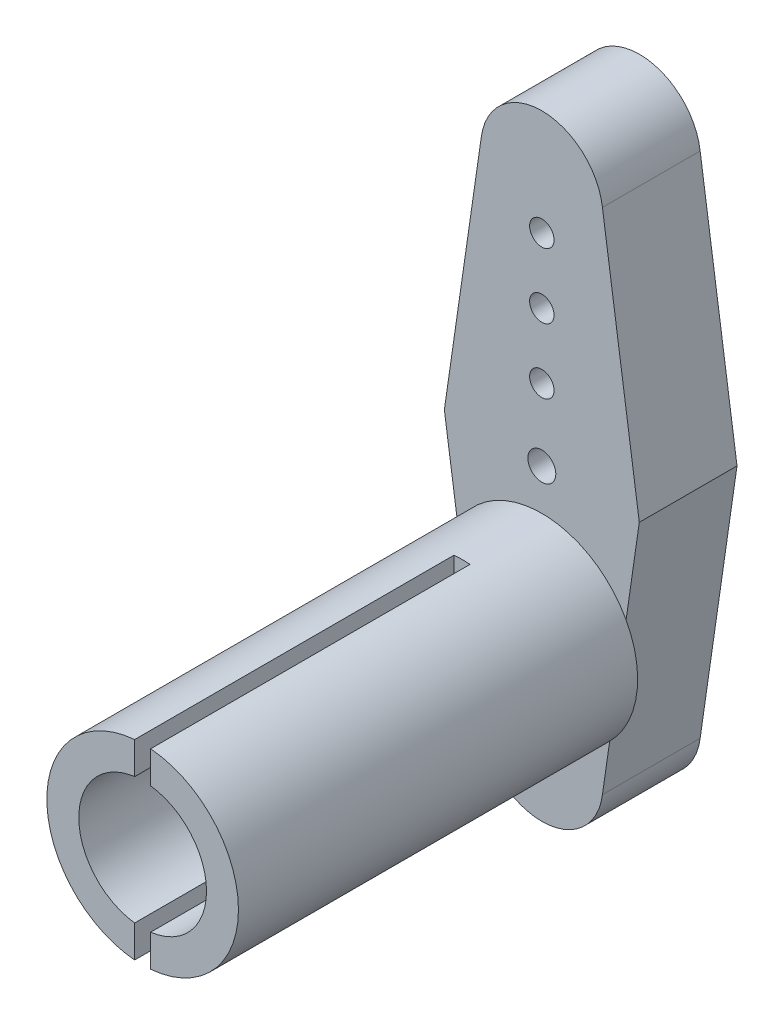
from build123d import *

# Parameters (mm, degrees)
BOSS_EXTRUDE1_DEPTH     = 6
CUT_EXTRUDE3_DEPTH      = 4.7
CUT_EXTRUDE4_DEPTH      = 21.471687766
CUT_EXTRUDE4_DEPTH_BACK = 21.471687766
SKETCH4_R               = 0.75
SKETCH6_R               = 0.75
CUT_EXTRUDE6_DEPTH      = 21.471687766
LPATTERN1_COUNT         = 3
LPATTERN1_PITCH         = 4
SCALE1_SCALE            = 1.02
SKETCH7_W               = 12.24
SKETCH7_H               = 6.12
CUT_EXTRUDE7_DEPTH      = 22.106506047
SKETCH8_R               = 0.875
CUT_EXTRUDE8_DEPTH      = 22.121773144
SKETCH9_R               = 6
SKETCH9_R_2             = 4
BOSS_EXTRUDE2_DEPTH     = 25
SKETCH10_W              = 1
SKETCH10_H              = 40
CUT_EXTRUDE9_DEPTH      = 38.052107321


with BuildPart() as part:
    # Sketch2 → Boss-Extrude1 (new body)
    with BuildSketch(Plane.XY):
        with BuildLine():
            Line((-6, 0), (-3.720572803, -15.718868867))
            ThreePointArc((-3.720572803, -15.718868867), (-5.969e-06, -19), (3.720571311, -15.71888071))
            Line((3.720571311, -15.71888071), (6, 0))
            ThreePointArc((6, 0), (0, 6), (-6, 0))
        make_face()
    extrude(amount=BOSS_EXTRUDE1_DEPTH)

    # Sketch3 → Cut-Extrude3 (cut)
    with BuildSketch(Plane.XY):
        with BuildLine():
            Line((-3.75, 0), (-2.25, -15))
            ThreePointArc((-2.25, -15), (0, -17.25), (2.25, -15))
            Line((2.25, -15), (3.75, 0))
            ThreePointArc((3.75, 0), (0, 3.75), (-3.75, 0))
        make_face()
    extrude(amount=CUT_EXTRUDE3_DEPTH, mode=Mode.SUBTRACT)

    # Sketch4 → Cut-Extrude4 (cut, two sides: drawn at the far end of the back side and taken through both)
    with BuildSketch(Plane(origin=(0, 0, 4.7), x_dir=(-1, 0, 0), z_dir=(0, 0, -1)).offset(-CUT_EXTRUDE4_DEPTH_BACK)):
        Circle(SKETCH4_R)
    extrude(amount=CUT_EXTRUDE4_DEPTH + CUT_EXTRUDE4_DEPTH_BACK, mode=Mode.SUBTRACT)

    # Sketch6 → Cut-Extrude6 (cut, symmetric)
    with BuildSketch(Plane(origin=(0, 0, 4.7), x_dir=(-1, 0, 0), z_dir=(0, 0, -1))):
        with Locations((0, -4.5)):
            Circle(SKETCH6_R)
    cut_extrude6 = extrude(amount=CUT_EXTRUDE6_DEPTH, both=True, mode=Mode.SUBTRACT)

    # LPattern1: Cut-Extrude6 ×3
    with Locations(*[(0, -i * LPATTERN1_PITCH, 0) for i in range(1, LPATTERN1_COUNT)]):
        add(cut_extrude6, mode=Mode.SUBTRACT)


with BuildPart() as part_1:
    # Scale1: scaled about (6e-08, -5.397561761, 3.434577722)
    add(part.part.scale(SCALE1_SCALE).moved(Location((-1e-09, 0.107951235, -0.068691554))))

    # Sketch7 → Cut-Extrude7 (cut, through all)
    with BuildSketch(Plane(origin=(0, 0, 0), x_dir=(1, 0, 0), z_dir=(0, 1, 0))):
        with Locations((-1e-09, -2.991308446)):
            Rectangle(SKETCH7_W, SKETCH7_H)
    extrude(amount=CUT_EXTRUDE7_DEPTH, mode=Mode.SUBTRACT)

    # Mirror3: part across plane


with BuildPart() as part_2:
    add(part_1.part)
    add(part_1.part.mirror(Plane.ZX))

    # Sketch8 → Cut-Extrude8 (cut, through all)
    with BuildSketch(Plane.XY.offset(6.051308446)):
        Circle(SKETCH8_R)
    extrude(amount=-CUT_EXTRUDE8_DEPTH, mode=Mode.SUBTRACT)

    # Sketch9 → Boss-Extrude2 (add)
    with BuildSketch(Plane.XY.offset(6.051308446)):
        with Locations(Location((-1e-09, -8.562048765, 0), (0, 0, 151.579121381))):
            Circle(SKETCH9_R)
        with Locations(Location((-1e-09, -8.562048765, 0), (0, 0, 100.806376462))):
            Circle(SKETCH9_R_2, mode=Mode.SUBTRACT)
    extrude(amount=BOSS_EXTRUDE2_DEPTH)

    # Sketch10 → Cut-Extrude9 (cut, through all)
    with BuildSketch(Plane(origin=(0, 0, 0), x_dir=(1, 0, 0), z_dir=(0, 1, 0))):
        with Locations((0, -31.051308446)):
            Rectangle(SKETCH10_W, SKETCH10_H)
    extrude(amount=-CUT_EXTRUDE9_DEPTH, mode=Mode.SUBTRACT)


solid = part_2.part
